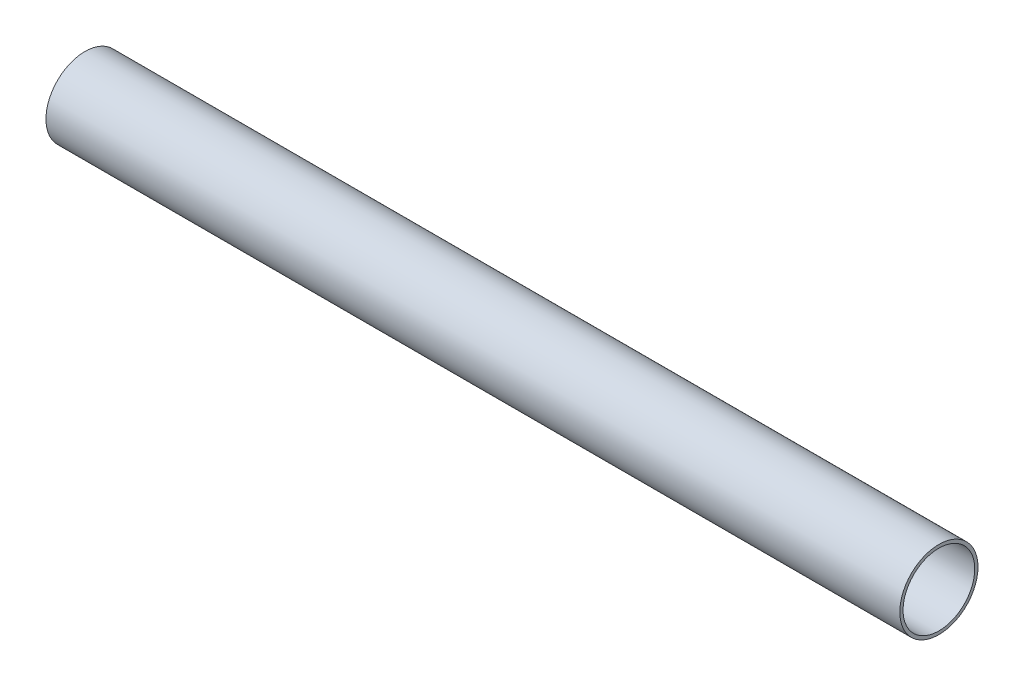
from build123d import *

# Parameters (mm, degrees)
SKETCH1_R           = 19.05
SKETCH1_R_2         = 17.4625
BOSS_EXTRUDE1_DEPTH = 415.9758


with BuildPart() as part:
    # Sketch1 → Boss-Extrude1 (new body)
    with BuildSketch(Plane(origin=(0, 0, 0), x_dir=(0, 0, -1), z_dir=(1, 0, 0))):
        Circle(SKETCH1_R)
        Circle(SKETCH1_R_2, mode=Mode.SUBTRACT)
    extrude(amount=BOSS_EXTRUDE1_DEPTH)


solid = part.part
